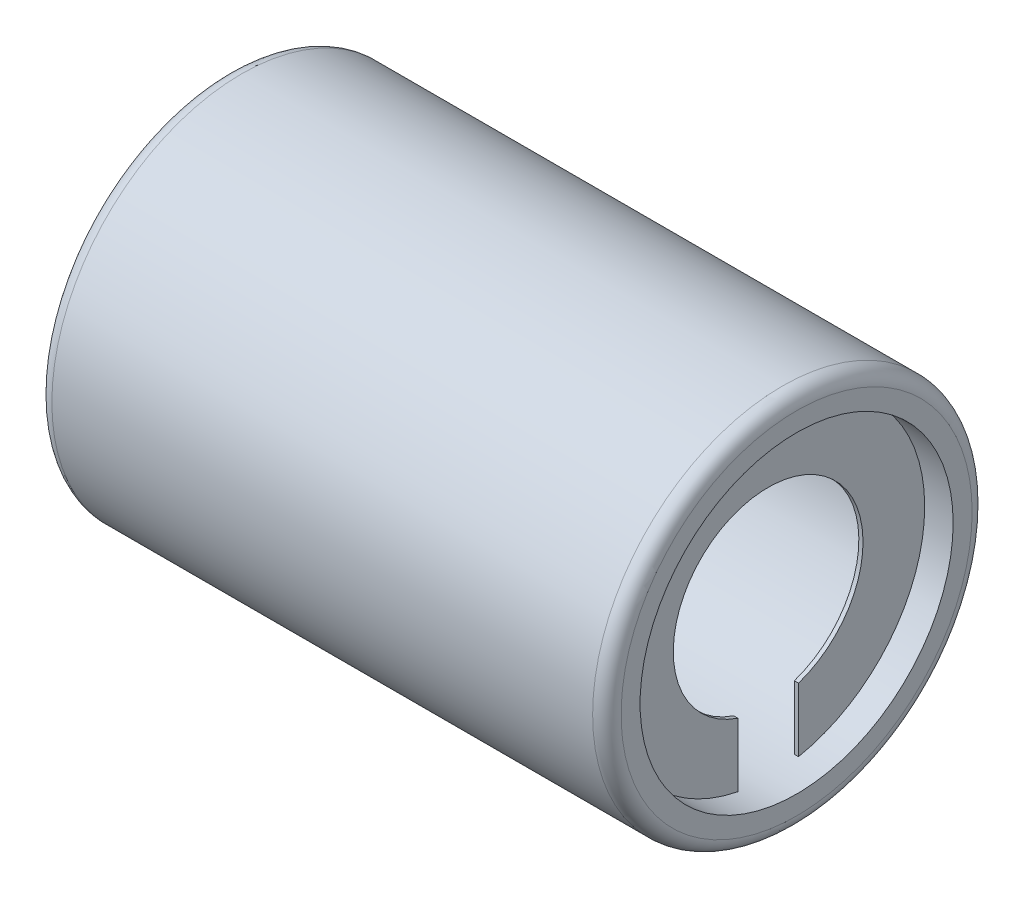
from build123d import *

# Parameters (mm, degrees)
SKETCH1_W                  = 12
SKETCH1_H                  = 4
F_6_6_6_6_DIAMETER_HOLE1_D = 6.6
BOSS_EXTRUDE1_DEPTH        = 0.088
FILLET1_R                  = 0.3


with BuildPart() as part:
    # Sketch1 → Revolve1 (revolve)
    with BuildSketch(Plane(origin=(0, 0, 0), x_dir=(-1, 0, 0), z_dir=(0, 0, -1)), mode=Mode.PRIVATE) as revolve1_sk:
        with Locations((-6, 2)):
            Rectangle(SKETCH1_W, SKETCH1_H)
    revolve(revolve1_sk.sketch.rotate(Axis((12, 0, 0), (-1, 0, 0)), 270), axis=Axis((12, 0, 0), (-1, 0, 0)))

    # Ø6.6 (6.6) Diameter Hole1 (through all)
    with Locations(Plane(origin=(12, 0, 0), x_dir=(0, 0, -1), z_dir=(1, 0, 0))):
        with Locations((0, 0)):
            Hole(F_6_6_6_6_DIAMETER_HOLE1_D / 2)

    # Sketch4 → Boss-Extrude1 (add)
    with BuildSketch(Plane(origin=(11.312, 0, 0), x_dir=(0, -1, 0), z_dir=(-1, 0, 0))):
        with BuildLine():
            Line((1.894835085, 0.64), (3.237344591, 0.64))
            ThreePointArc((3.237344591, 0.64), (-3.3, 0), (3.237344591, -0.64))
            Line((3.237344591, -0.64), (1.894835085, -0.64))
            ThreePointArc((1.894835085, -0.64), (2, 0), (1.894835085, 0.64))
        make_face()
    extrude(amount=-BOSS_EXTRUDE1_DEPTH)

    # Sketch5 → Cut-Revolve1 (revolve, cut)
    with BuildSketch(Plane(origin=(0, 0, 0), x_dir=(-1, 0, 0), z_dir=(0, 0, -1)), mode=Mode.PRIVATE) as cut_revolve1_sk:
        Polygon((-11.4, 2), (-11.4, 0), (0, 0), (0, 3.3), (-0.6, 3.3), (-0.6, 2), align=None)
    revolve(cut_revolve1_sk.sketch.rotate(Axis((11.4, 0, 0), (-1, 0, 0)), 90), axis=Axis((11.4, 0, 0), (-1, 0, 0)), mode=Mode.SUBTRACT)

    # Fillet1
    fillet1_edges = [part.edges().sort_by_distance(p)[0] for p in [
        (0, 0, -4),
        (12, 0, -4),
    ]]
    fillet(fillet1_edges, radius=FILLET1_R)


solid = part.part
